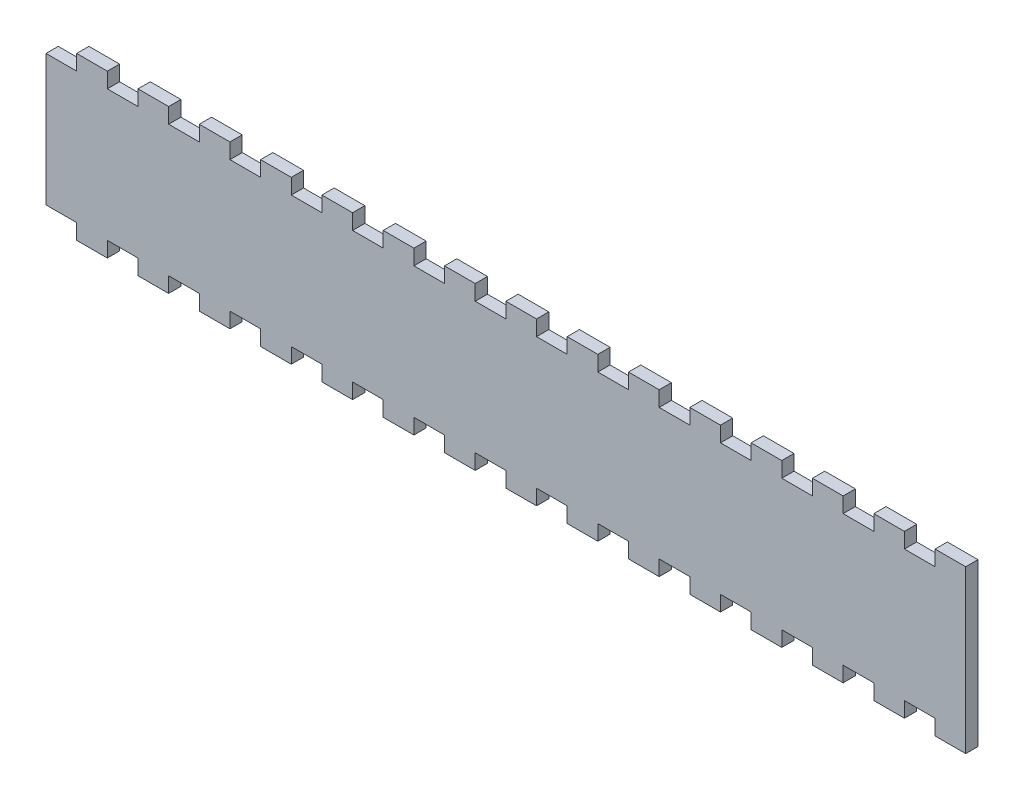
from build123d import *

# Parameters (mm, degrees)
SKETCH1_W           = 150
SKETCH1_H           = 21.4
BOSS_EXTRUDE2_DEPTH = 2
SKETCH2_W           = 5
SKETCH2_H           = 2
BOSS_EXTRUDE3_DEPTH = 2.5
LPATTERN1_COUNT     = 15
LPATTERN1_PITCH     = 10
SKETCH3_W           = 5
SKETCH3_H           = 2
BOSS_EXTRUDE4_DEPTH = 2.5
LPATTERN2_COUNT     = 15
LPATTERN2_PITCH     = 10


with BuildPart() as part:
    # Sketch1 → Boss-Extrude2 (new body)
    with BuildSketch(Plane.XY):
        with Locations((75, 10.7)):
            Rectangle(SKETCH1_W, SKETCH1_H)
    extrude(amount=BOSS_EXTRUDE2_DEPTH)

    # Sketch2 → Boss-Extrude3 (add)
    with BuildSketch(Plane(origin=(0, 21.4, 0), x_dir=(1, 0, 0), z_dir=(0, 1, 0))):
        with Locations((7.5, -1)):
            Rectangle(SKETCH2_W, SKETCH2_H)
    boss_extrude3 = extrude(amount=BOSS_EXTRUDE3_DEPTH)

    # LPattern1: Boss-Extrude3 ×15
    with Locations(*[(i * LPATTERN1_PITCH, 0, 0) for i in range(1, LPATTERN1_COUNT)]):
        add(boss_extrude3)

    # Sketch3 → Boss-Extrude4 (add)
    with BuildSketch(Plane(origin=(0, 0, 0), x_dir=(-1, 0, 0), z_dir=(0, -1, 0))):
        with Locations((-7.5, -1)):
            Rectangle(SKETCH3_W, SKETCH3_H)
    boss_extrude4 = extrude(amount=BOSS_EXTRUDE4_DEPTH)

    # LPattern2: Boss-Extrude4 ×15
    with Locations(*[(i * LPATTERN2_PITCH, 0, 0) for i in range(1, LPATTERN2_COUNT)]):
        add(boss_extrude4)


solid = part.part
